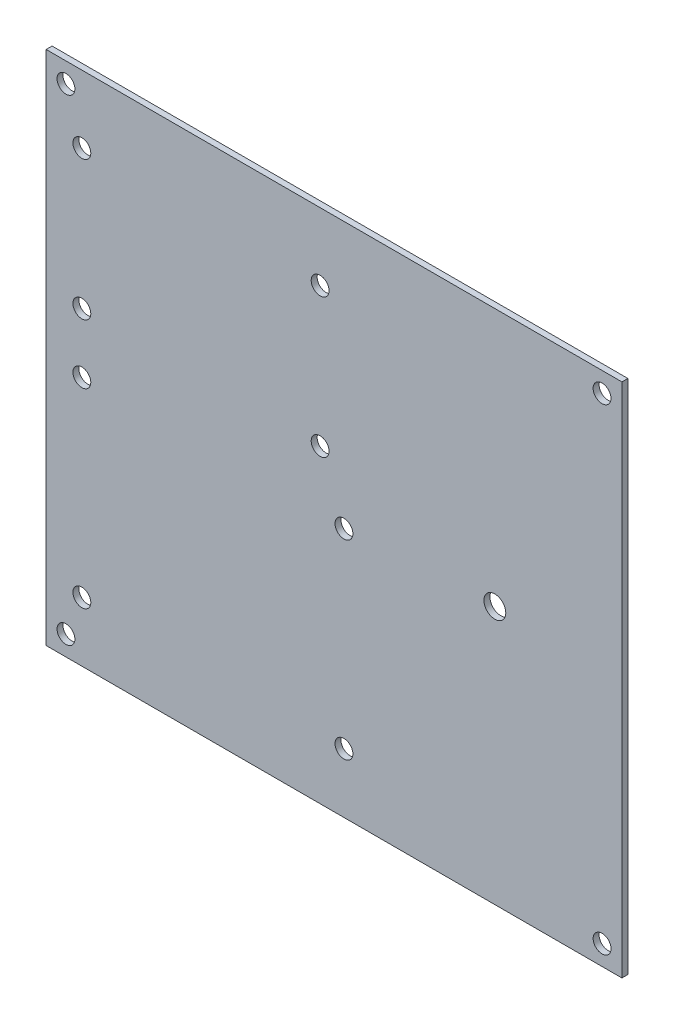
from build123d import *

# Parameters (mm, degrees)
SKETCH_1_W      = 145
SKETCH_1_H      = 130
SKETCH_1_R      = 2.25
SKETCH_1_R_2    = 2.75
EXTRUDE_1_DEPTH = 1.5


with BuildPart() as part:
    # Эскиз1 → Вытянуть1 (new body)
    with BuildSketch(Plane.XY):
        Rectangle(SKETCH_1_W, SKETCH_1_H)
        with Locations((-67.5, 60)):
            Circle(SKETCH_1_R, mode=Mode.SUBTRACT)
        with Locations(Location((-67.5, -60, 0), (0, 0, 180))):
            Circle(SKETCH_1_R, mode=Mode.SUBTRACT)
        with Locations((67.5, -60)):
            Circle(SKETCH_1_R, mode=Mode.SUBTRACT)
        with Locations(Location((67.5, 60, 0), (0, 0, 180))):
            Circle(SKETCH_1_R, mode=Mode.SUBTRACT)
        with Locations((-63.5, -2)):
            Circle(SKETCH_1_R, mode=Mode.SUBTRACT)
        with Locations(Location((-63.5, -50, 0), (0, 0, 180))):
            Circle(SKETCH_1_R, mode=Mode.SUBTRACT)
        with Locations((2.5, -2)):
            Circle(SKETCH_1_R, mode=Mode.SUBTRACT)
        with Locations(Location((2.5, -50, 0), (0, 0, 180))):
            Circle(SKETCH_1_R, mode=Mode.SUBTRACT)
        with Locations((40.5, 0)):
            Circle(SKETCH_1_R_2, mode=Mode.SUBTRACT)
        with Locations((-63.5, 13)):
            Circle(SKETCH_1_R, mode=Mode.SUBTRACT)
        with Locations((-63.5, 48)):
            Circle(SKETCH_1_R, mode=Mode.SUBTRACT)
        with Locations((-3.5, 13)):
            Circle(SKETCH_1_R, mode=Mode.SUBTRACT)
        with Locations((-3.5, 48)):
            Circle(SKETCH_1_R, mode=Mode.SUBTRACT)
    extrude(amount=EXTRUDE_1_DEPTH)


solid = part.part
